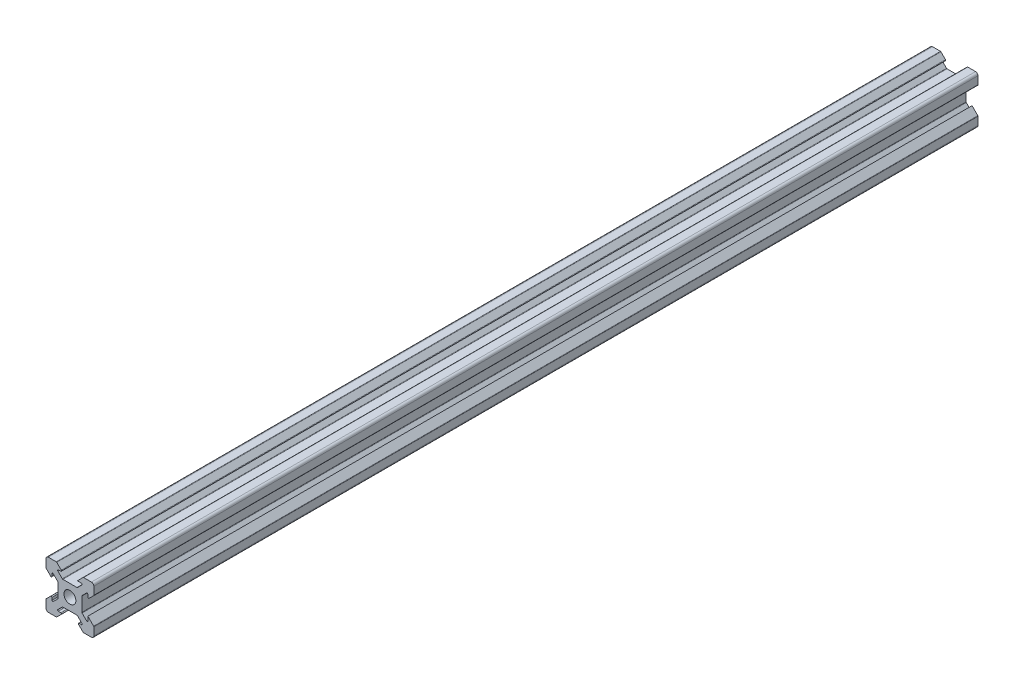
from build123d import *

# Parameters (mm, degrees)
CROQUIS11_R                = 2.5
MIEMBRO_ESTRUCTURAL1_DEPTH = 370


with BuildPart() as part:
    # Croquis11 → Miembro estructural1 (new body)
    with BuildSketch(Plane.XY.offset(-185)):
        with BuildLine():
            Line((-9, -10), (-5.713990218, -10))
            ThreePointArc((-5.713990218, -10), (-5.599185189, -9.97716386), (-5.501858184, -9.912132034))
            Line((-5.501858184, -9.912132034), (-3.612132034, -8.022405885))
            ThreePointArc((-3.612132034, -8.022405885), (-3.547100209, -7.695468821), (-3.824264069, -7.51027385))
            Line((-3.824264069, -7.51027385), (-4.847118775, -7.51027385))
            ThreePointArc((-4.847118775, -7.51027385), (-5.124282635, -7.32507888), (-5.059250809, -6.998141816))
            Line((-5.059250809, -6.998141816), (-3.16952466, -5.108415666))
            ThreePointArc((-3.16952466, -5.108415666), (-3.072197655, -5.043383841), (-2.957392625, -5.0205477))
            Line((-2.957392625, -5.0205477), (2.957392625, -5.0205477))
            ThreePointArc((2.957392625, -5.0205477), (3.072197655, -5.043383841), (3.16952466, -5.108415666))
            Line((3.16952466, -5.108415666), (5.059250809, -6.998141816))
            ThreePointArc((5.059250809, -6.998141816), (5.124282635, -7.32507888), (4.847118775, -7.51027385))
            Line((4.847118775, -7.51027385), (3.824264069, -7.51027385))
            ThreePointArc((3.824264069, -7.51027385), (3.547100209, -7.695468821), (3.612132034, -8.022405885))
            Line((3.612132034, -8.022405885), (5.501858184, -9.912132034))
            ThreePointArc((5.501858184, -9.912132034), (5.599185189, -9.97716386), (5.713990218, -10))
            Line((5.713990218, -10), (9, -10))
            ThreePointArc((9, -10), (9.707106781, -9.707106781), (10, -9))
            Line((10, -9), (10, -5.713990218))
            ThreePointArc((10, -5.713990218), (9.97716386, -5.599185189), (9.912132034, -5.501858184))
            Line((9.912132034, -5.501858184), (7.51027385, -3.1))
            Line((7.51027385, -3.1), (7.51027385, -4.847118775))
            ThreePointArc((7.51027385, -4.847118775), (7.32507888, -5.124282635), (6.998141816, -5.059250809))
            Line((6.998141816, -5.059250809), (5.108415666, -3.16952466))
            ThreePointArc((5.108415666, -3.16952466), (5.043383841, -3.072197655), (5.0205477, -2.957392625))
            Line((5.0205477, -2.957392625), (5.0205477, 2.957392625))
            ThreePointArc((5.0205477, 2.957392625), (5.043383841, 3.072197655), (5.108415666, 3.16952466))
            Line((5.108415666, 3.16952466), (6.998141816, 5.059250809))
            ThreePointArc((6.998141816, 5.059250809), (7.32507888, 5.124282635), (7.51027385, 4.847118775))
            Line((7.51027385, 4.847118775), (7.51027385, 3.824264069))
            ThreePointArc((7.51027385, 3.824264069), (7.695468821, 3.547100209), (8.022405885, 3.612132034))
            Line((8.022405885, 3.612132034), (9.912132034, 5.501858184))
            ThreePointArc((9.912132034, 5.501858184), (9.97716386, 5.599185189), (10, 5.713990218))
            Line((10, 5.713990218), (10, 9))
            ThreePointArc((10, 9), (9.707106781, 9.707106781), (9, 10))
            Line((9, 10), (5.713990218, 10))
            ThreePointArc((5.713990218, 10), (5.599185189, 9.97716386), (5.501858184, 9.912132034))
            Line((5.501858184, 9.912132034), (3.1, 7.51027385))
            Line((3.1, 7.51027385), (4.847118775, 7.51027385))
            ThreePointArc((4.847118775, 7.51027385), (5.124282635, 7.32507888), (5.059250809, 6.998141816))
            Line((5.059250809, 6.998141816), (3.16952466, 5.108415666))
            ThreePointArc((3.16952466, 5.108415666), (3.072197655, 5.043383841), (2.957392625, 5.0205477))
            Line((2.957392625, 5.0205477), (-2.957392625, 5.0205477))
            ThreePointArc((-2.957392625, 5.0205477), (-3.072197655, 5.043383841), (-3.16952466, 5.108415666))
            Line((-3.16952466, 5.108415666), (-5.059250809, 6.998141816))
            ThreePointArc((-5.059250809, 6.998141816), (-5.124282635, 7.32507888), (-4.847118775, 7.51027385))
            Line((-4.847118775, 7.51027385), (-3.824264069, 7.51027385))
            ThreePointArc((-3.824264069, 7.51027385), (-3.547100209, 7.695468821), (-3.612132034, 8.022405885))
            Line((-3.612132034, 8.022405885), (-5.501858184, 9.912132034))
            ThreePointArc((-5.501858184, 9.912132034), (-5.599185189, 9.97716386), (-5.713990218, 10))
            Line((-5.713990218, 10), (-9, 10))
            ThreePointArc((-9, 10), (-9.707106781, 9.707106781), (-10, 9))
            Line((-10, 9), (-10, 5.713990218))
            ThreePointArc((-10, 5.713990218), (-9.97716386, 5.599185189), (-9.912132034, 5.501858184))
            Line((-9.912132034, 5.501858184), (-8.022405885, 3.612132034))
            ThreePointArc((-8.022405885, 3.612132034), (-7.695468821, 3.547100209), (-7.51027385, 3.824264069))
            Line((-7.51027385, 3.824264069), (-7.51027385, 4.847118775))
            ThreePointArc((-7.51027385, 4.847118775), (-7.32507888, 5.124282635), (-6.998141816, 5.059250809))
            Line((-6.998141816, 5.059250809), (-5.108415666, 3.16952466))
            ThreePointArc((-5.108415666, 3.16952466), (-5.043383841, 3.072197655), (-5.0205477, 2.957392625))
            Line((-5.0205477, 2.957392625), (-5.0205477, -2.957392625))
            ThreePointArc((-5.0205477, -2.957392625), (-5.043383841, -3.072197655), (-5.108415666, -3.16952466))
            Line((-5.108415666, -3.16952466), (-6.998141816, -5.059250809))
            ThreePointArc((-6.998141816, -5.059250809), (-7.32507888, -5.124282635), (-7.51027385, -4.847118775))
            Line((-7.51027385, -4.847118775), (-7.51027385, -3.824264069))
            ThreePointArc((-7.51027385, -3.824264069), (-7.695468821, -3.547100209), (-8.022405885, -3.612132034))
            Line((-8.022405885, -3.612132034), (-9.912132034, -5.501858184))
            ThreePointArc((-9.912132034, -5.501858184), (-9.97716386, -5.599185189), (-10, -5.713990218))
            Line((-10, -5.713990218), (-10, -9))
            ThreePointArc((-10, -9), (-9.707106781, -9.707106781), (-9, -10))
        make_face()
        Circle(CROQUIS11_R, mode=Mode.SUBTRACT)
    extrude(amount=MIEMBRO_ESTRUCTURAL1_DEPTH)


solid = part.part
